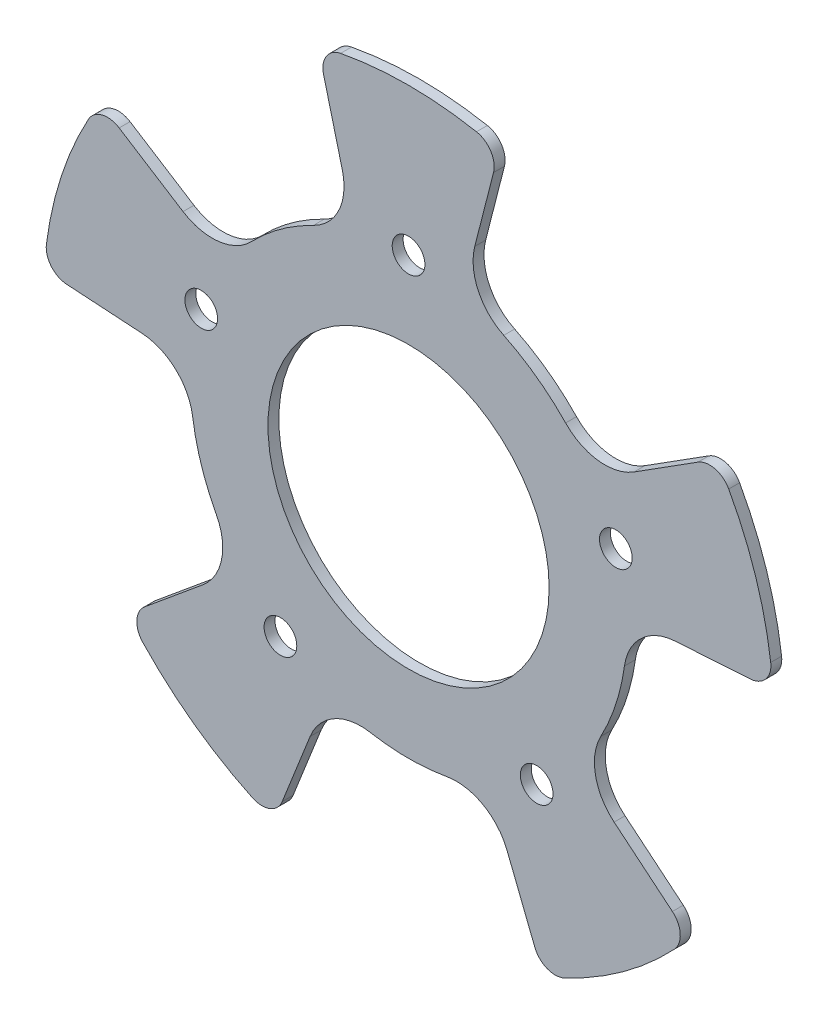
from build123d import *

# Parameters (mm, degrees)
SKETCH_1_R      = 12.9
SKETCH_1_R_2    = 1.5
EXTRUDE_1_DEPTH = 1


with BuildPart() as part:
    # 草图1 → 凸台-拉伸1 (new body)
    with BuildSketch(Plane.XY):
        with BuildLine():
            Line((-24.208730048, -20.05461018), (-18.863150132, -15.626310092))
            ThreePointArc((-18.863150132, -15.626310092), (-17.146898547, -12.74106365), (-17.642285858, -9.420708556))
            ThreePointArc((-17.642285858, -9.420708556), (-19.021130326, -6.180339887), (-19.810262634, -2.748362124))
            ThreePointArc((-19.810262634, -2.748362124), (-21.361141637, 0.229042931), (-24.445523644, 1.554468964))
            Line((-24.445523644, 1.554468964), (-31.373078125, 1.994985952))
            ThreePointArc((-31.373078125, 1.994985952), (-32.788486399, 2.717684101), (-33.230039203, 4.244348542))
            ThreePointArc((-33.230039203, 4.244348542), (-31.860393296, 10.352069312), (-29.378431918, 16.098376876))
            ThreePointArc((-29.378431918, 16.098376876), (-28.123857351, 17.073936127), (-26.55397669, 16.826655102))
            Line((-26.55397669, 16.826655102), (-20.690537997, 13.111126473))
            ThreePointArc((-20.690537997, 13.111126473), (-17.41615466, 12.370464403), (-14.41139241, 13.867651885))
            ThreePointArc((-14.41139241, 13.867651885), (-11.755705046, 16.180339888), (-8.735555524, 17.991388765))
            ThreePointArc((-8.735555524, 17.991388765), (-6.383123013, 20.386431107), (-6.075694405, 23.729431883))
            Line((-6.075694405, 23.729431883), (-7.797469917, 30.45405495))
            ThreePointArc((-7.797469917, 30.45405495), (-7.547528343, 32.023514221), (-6.232031499, 32.915221151))
            ThreePointArc((-6.232031499, 32.915221151), (0, 33.5), (6.232031499, 32.915221151))
            ThreePointArc((6.232031499, 32.915221151), (7.547528343, 32.023514221), (7.797469917, 30.45405495))
            Line((7.797469917, 30.45405495), (6.075694405, 23.729431883))
            ThreePointArc((6.075694405, 23.729431883), (6.383123013, 20.386431107), (8.735555524, 17.991388765))
            ThreePointArc((8.735555524, 17.991388765), (11.755705046, 16.180339887), (14.41139241, 13.867651885))
            ThreePointArc((14.41139241, 13.867651885), (17.41615466, 12.370464403), (20.690537997, 13.111126473))
            Line((20.690537997, 13.111126473), (26.55397669, 16.826655102))
            ThreePointArc((26.55397669, 16.826655102), (28.123857351, 17.073936127), (29.378431918, 16.098376876))
            ThreePointArc((29.378431918, 16.098376876), (31.860393296, 10.352069312), (33.230039203, 4.244348542))
            ThreePointArc((33.230039203, 4.244348542), (32.788486399, 2.717684101), (31.373078125, 1.994985952))
            Line((31.373078125, 1.994985952), (24.445523644, 1.554468964))
            ThreePointArc((24.445523644, 1.554468964), (21.361141637, 0.229042931), (19.810262634, -2.748362124))
            ThreePointArc((19.810262634, -2.748362124), (19.021130326, -6.180339888), (17.642285858, -9.420708556))
            ThreePointArc((17.642285858, -9.420708556), (17.146898547, -12.74106365), (18.863150132, -15.626310092))
            Line((18.863150132, -15.626310092), (24.208730048, -20.05461018))
            ThreePointArc((24.208730048, -20.05461018), (24.929028081, -21.471241373), (24.388900961, -22.965877077))
            ThreePointArc((24.388900961, -22.965877077), (19.690805952, -27.102069312), (14.305262176, -30.292069492))
            ThreePointArc((14.305262176, -30.292069492), (12.71687069, -30.343893076), (11.592158696, -29.221085825))
            Line((11.592158696, -29.221085825), (9.03247008, -22.768717229))
            ThreePointArc((9.03247008, -22.768717229), (6.818788557, -20.244874791), (3.50786011, -19.689969971))
            ThreePointArc((3.50786011, -19.689969971), (0, -20), (-3.50786011, -19.689969971))
            ThreePointArc((-3.50786011, -19.689969971), (-6.818788557, -20.244874791), (-9.03247008, -22.768717229))
            Line((-9.03247008, -22.768717229), (-11.592158696, -29.221085825))
            ThreePointArc((-11.592158696, -29.221085825), (-12.71687069, -30.343893076), (-14.305262176, -30.292069492))
            ThreePointArc((-14.305262176, -30.292069492), (-19.690805952, -27.102069312), (-24.388900961, -22.965877077))
            ThreePointArc((-24.388900961, -22.965877077), (-24.929028081, -21.471241373), (-24.208730048, -20.05461018))
        make_face()
        Circle(SKETCH_1_R, mode=Mode.SUBTRACT)
        with Locations((-11.755705046, -16.180339887)):
            Circle(SKETCH_1_R_2, mode=Mode.SUBTRACT)
        with Locations((-19.021130326, 6.180339888)):
            Circle(SKETCH_1_R_2, mode=Mode.SUBTRACT)
        with Locations((0, 20)):
            Circle(SKETCH_1_R_2, mode=Mode.SUBTRACT)
        with Locations((19.021130326, 6.180339887)):
            Circle(SKETCH_1_R_2, mode=Mode.SUBTRACT)
        with Locations((11.755705046, -16.180339888)):
            Circle(SKETCH_1_R_2, mode=Mode.SUBTRACT)
    extrude(amount=EXTRUDE_1_DEPTH)


solid = part.part
